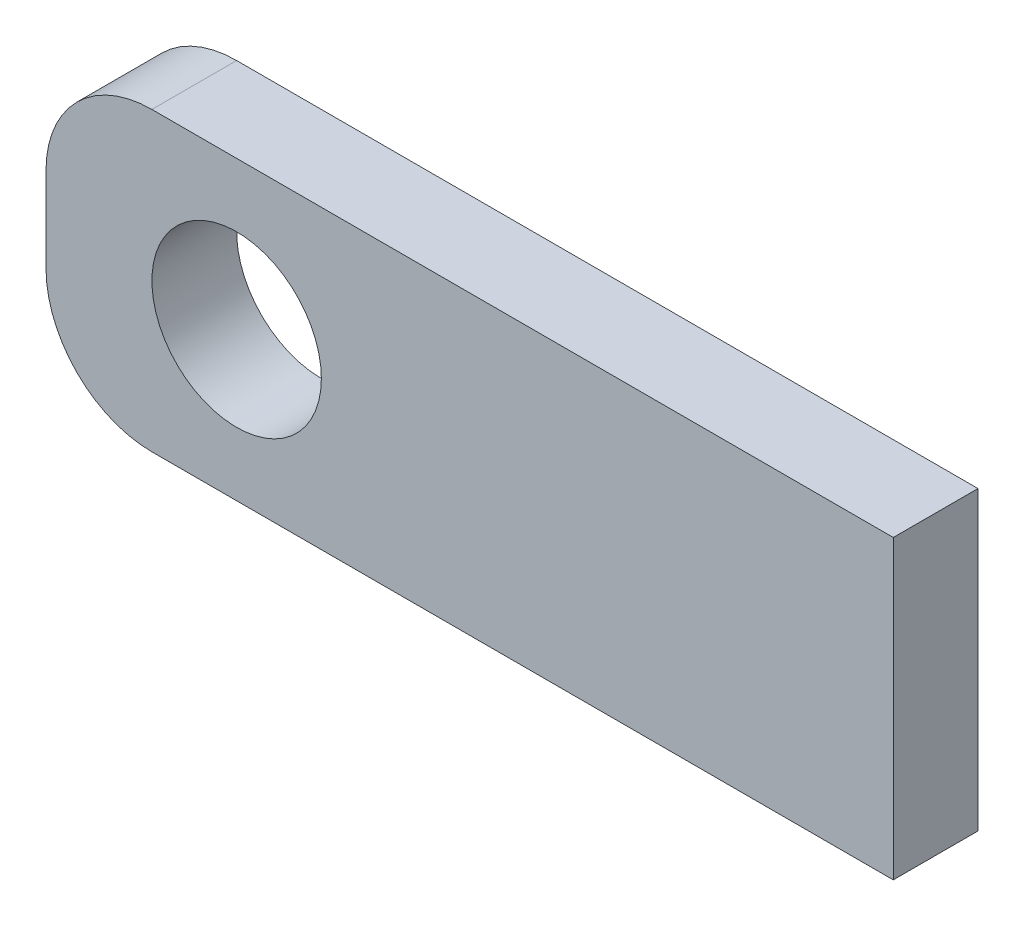
from build123d import *

# Parameters (mm, degrees)
SKETCH1_W           = 40
SKETCH1_H           = 14
SKETCH1_R           = 4
BOSS_EXTRUDE1_DEPTH = 4
FILLET1_R           = 5


with BuildPart() as part:
    # Sketch1 → Boss-Extrude1 (new body)
    with BuildSketch(Plane.XY):
        with Locations((-20, 7)):
            Rectangle(SKETCH1_W, SKETCH1_H)
        with Locations((-31, 7)):
            Circle(SKETCH1_R, mode=Mode.SUBTRACT)
    extrude(amount=BOSS_EXTRUDE1_DEPTH)

    # Fillet1
    fillet1_edges = [part.edges().sort_by_distance(p)[0] for p in [
        (-40, 0, 2),
        (-40, 14, 2),
    ]]
    fillet(fillet1_edges, radius=FILLET1_R)


solid = part.part
